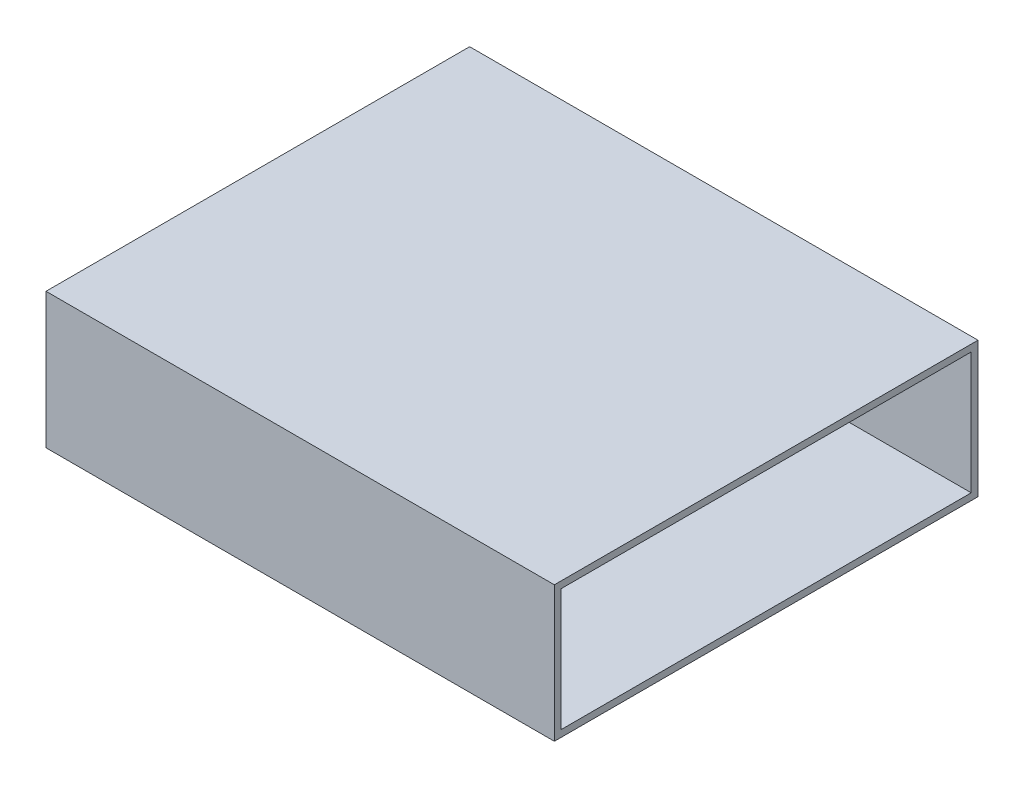
from build123d import *

# Parameters (mm, degrees)
BOSS_EXTRUDE1_DEPTH      = 150
BOSS_EXTRUDE1_DEPTH_BACK = 150
SKETCH1_W                = 250
SKETCH1_H                = 80
SKETCH1_W_2              = 242
SKETCH1_H_2              = 72


with BuildPart() as part:
    # Sketch1 → Boss-Extrude1 (new, two sides: drawn at the far end of the back side and taken through both)
    with BuildSketch(Plane(origin=(0, 0, 0), x_dir=(0, 0, -1), z_dir=(1, 0, 0)).offset(-BOSS_EXTRUDE1_DEPTH_BACK)):
        Rectangle(SKETCH1_W, SKETCH1_H)
        Rectangle(SKETCH1_W_2, SKETCH1_H_2, mode=Mode.SUBTRACT)
    extrude(amount=BOSS_EXTRUDE1_DEPTH + BOSS_EXTRUDE1_DEPTH_BACK)


solid = part.part
